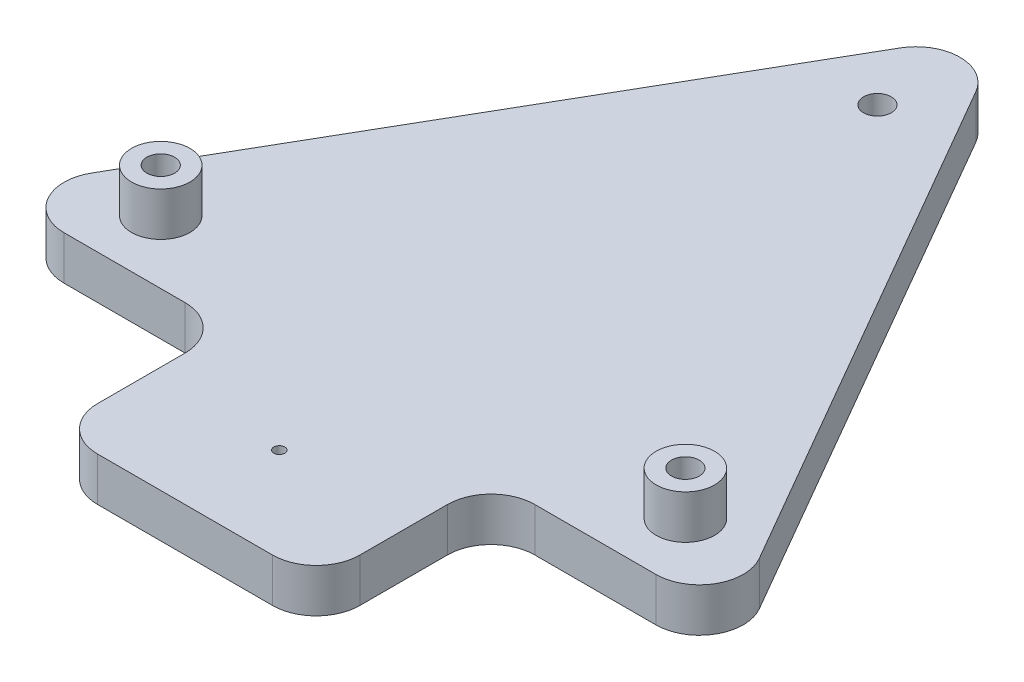
from build123d import *

# Parameters (mm, degrees)
SKETCH1_R           = 3.175
SKETCH1_R_2         = 1.25
BOSS_EXTRUDE2_DEPTH = 10
SKETCH2_R           = 6.675
SKETCH2_R_2         = 3.175
BOSS_EXTRUDE3_DEPTH = 10


with BuildPart() as part:
    # Sketch1 → Boss-Extrude2 (new body)
    with BuildSketch(Plane(origin=(0, 0, 0), x_dir=(1, 0, 0), z_dir=(0, 1, 0))):
        with BuildLine():
            Line((-67.679491924, 0), (-40, 0))
            ThreePointArc((-40, 0), (-32.928932188, -2.928932188), (-30, -10))
            Line((-30, -10), (-30, -30))
            ThreePointArc((-30, -30), (-27.071067812, -37.071067812), (-20, -40))
            Line((-20, -40), (20, -40))
            ThreePointArc((20, -40), (27.071067812, -37.071067812), (30, -30))
            Line((30, -30), (30, -10))
            ThreePointArc((30, -10), (32.928932188, -2.928932188), (40, 0))
            Line((40, 0), (67.679491924, 0))
            ThreePointArc((67.679491924, 0), (76.339745962, 5), (76.339745962, 15))
            Line((76.339745962, 15), (8.660254038, 132.224318643))
            ThreePointArc((8.660254038, 132.224318643), (0, 137.224318643), (-8.660254038, 132.224318643))
            Line((-8.660254038, 132.224318643), (-76.339745962, 15))
            ThreePointArc((-76.339745962, 15), (-76.339745962, 5), (-67.679491924, 0))
        make_face()
        with Locations(Location((-60, 14.43375673, 0), (0, 0, 270))):
            Circle(SKETCH1_R, mode=Mode.SUBTRACT)
        with Locations(Location((0, 118.356805184, 0), (0, 0, 270))):
            Circle(SKETCH1_R, mode=Mode.SUBTRACT)
        with Locations(Location((60, 14.43375673, 0), (0, 0, 270))):
            Circle(SKETCH1_R, mode=Mode.SUBTRACT)
        with Locations(Location((0, -18.450194816, 0), (0, 0, 270))):
            Circle(SKETCH1_R_2, mode=Mode.SUBTRACT)
    extrude(amount=BOSS_EXTRUDE2_DEPTH)

    # Sketch2 → Boss-Extrude3 (add)
    # profile 1 of 2: a face of its own
    with BuildSketch(Plane(origin=(0, 10, 0), x_dir=(1, 0, 0), z_dir=(0, 1, 0))):
        with Locations(Location((-60, 14.43375673, 0), (0, 0, 270))):
            Circle(SKETCH2_R)
        with Locations(Location((-60, 14.43375673, 0), (0, 0, 270))):
            Circle(SKETCH2_R_2, mode=Mode.SUBTRACT)
    # profile 2 of 2: a face of its own
    with BuildSketch(Plane(origin=(0, 10, 0), x_dir=(1, 0, 0), z_dir=(0, 1, 0))):
        with Locations(Location((60, 14.43375673, 0), (0, 0, 270))):
            Circle(SKETCH2_R)
        with Locations(Location((60, 14.43375673, 0), (0, 0, 270))):
            Circle(SKETCH2_R_2, mode=Mode.SUBTRACT)
    extrude(amount=BOSS_EXTRUDE3_DEPTH)


solid = part.part
